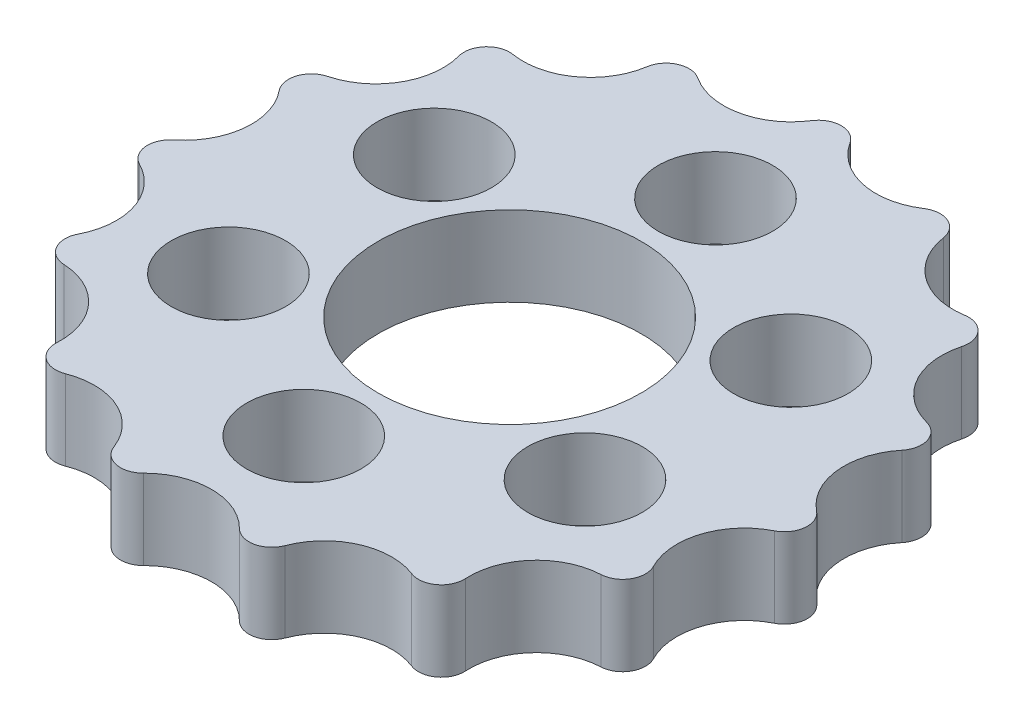
from build123d import *

# Parameters (mm, degrees)
BOSS_EXTRUDE1_DEPTH = 7
SKETCH2_R           = 5
SKETCH2_R_2         = 11.5
CUT_EXTRUDE1_DEPTH  = 42.502327226


with BuildPart() as part:
    # Sketch1 → Boss-Extrude1 (new body)
    with BuildSketch(Plane(origin=(0, 0, 0), x_dir=(1, 0, 0), z_dir=(0, 1, 0))):
        with BuildLine():
            ThreePointArc((1.682317925, 28.081575887), (0, 29), (-1.682317925, 28.081575887))
            ThreePointArc((-1.682317925, 28.081575887), (-5.420186592, 25.49997304), (-9.884932009, 26.33805644))
            ThreePointArc((-9.884932009, 26.33805644), (-11.795362649, 26.492818272), (-12.958679807, 24.969535749))
            ThreePointArc((-12.958679807, 24.969535749), (-15.323360273, 21.090796041), (-19.742987398, 20.040447761))
            ThreePointArc((-19.742987398, 20.040447761), (-21.551199939, 19.404787584), (-21.994368225, 17.540036039))
            ThreePointArc((-21.994368225, 17.540036039), (-22.576985755, 13.034828803), (-26.187300906, 10.277663603))
            ThreePointArc((-26.187300906, 10.277663603), (-27.580638973, 8.961492837), (-27.227030564, 7.077704752))
            ThreePointArc((-27.227030564, 7.077704752), (-25.926845294, 2.725021248), (-28.103592183, -1.262221962))
            ThreePointArc((-28.103592183, -1.262221962), (-28.841134966, -3.031325435), (-27.751891968, -4.608425985))
            ThreePointArc((-27.751891968, -4.608425985), (-24.793717744, -8.055967238), (-25.160517059, -12.583857883))
            ThreePointArc((-25.160517059, -12.583857883), (-25.11473671, -14.5), (-23.478199133, -15.497718004))
            ThreePointArc((-23.478199133, -15.497718004), (-19.373531152, -17.444005802), (-17.866959959, -21.729630455))
            ThreePointArc((-17.866959959, -21.729630455), (-17.045772316, -23.461492837), (-15.144912376, -23.707313787))
            ThreePointArc((-15.144912376, -23.707313787), (-10.603485021, -23.815817289), (-7.484043166, -27.118152514))
            ThreePointArc((-7.484043166, -27.118152514), (-6.029439034, -28.366280421), (-4.192932681, -27.817699643))
            ThreePointArc((-4.192932681, -27.817699643), (0, -26.069657606), (4.192932681, -27.817699643))
            ThreePointArc((4.192932681, -27.817699643), (6.029439034, -28.366280421), (7.484043166, -27.118152514))
            ThreePointArc((7.484043166, -27.118152514), (10.603485021, -23.815817289), (15.144912376, -23.707313787))
            ThreePointArc((15.144912376, -23.707313787), (17.045772316, -23.461492837), (17.866959959, -21.729630455))
            ThreePointArc((17.866959959, -21.729630455), (19.373531152, -17.444005802), (23.478199133, -15.497718004))
            ThreePointArc((23.478199133, -15.497718004), (25.11473671, -14.5), (25.160517059, -12.583857883))
            ThreePointArc((25.160517059, -12.583857883), (24.793717744, -8.055967238), (27.751891968, -4.608425985))
            ThreePointArc((27.751891968, -4.608425985), (28.841134966, -3.031325435), (28.103592183, -1.262221962))
            ThreePointArc((28.103592183, -1.262221962), (25.926845294, 2.725021248), (27.227030564, 7.077704752))
            ThreePointArc((27.227030564, 7.077704752), (27.580638973, 8.961492837), (26.187300906, 10.277663603))
            ThreePointArc((26.187300906, 10.277663603), (22.576985755, 13.034828803), (21.994368225, 17.540036039))
            ThreePointArc((21.994368225, 17.540036039), (21.551199939, 19.404787584), (19.742987398, 20.040447761))
            ThreePointArc((19.742987398, 20.040447761), (15.323360273, 21.090796041), (12.958679807, 24.969535749))
            ThreePointArc((12.958679807, 24.969535749), (11.795362649, 26.492818272), (9.884932009, 26.33805644))
            ThreePointArc((9.884932009, 26.33805644), (5.420186592, 25.49997304), (1.682317925, 28.081575887))
        make_face()
    extrude(amount=BOSS_EXTRUDE1_DEPTH)

    # Sketch2 → Cut-Extrude1 (cut, through all)
    with BuildSketch(Plane(origin=(0, 7, 0), x_dir=(1, 0, 0), z_dir=(0, 1, 0))):
        with Locations(Location((0, 18, 0), (0, 0, 270))):
            Circle(SKETCH2_R)
        with Locations(Location((0, 0, 0), (0, 0, 270))):
            Circle(SKETCH2_R_2)
        with Locations(Location((-15.588457268, -9, 0), (0, 0, 270))):
            Circle(SKETCH2_R)
        with Locations(Location((0, -18, 0), (0, 0, 270))):
            Circle(SKETCH2_R)
        with Locations(Location((15.588457268, -9, 0), (0, 0, 270))):
            Circle(SKETCH2_R)
        with Locations(Location((15.588457268, 9, 0), (0, 0, 270))):
            Circle(SKETCH2_R)
        with Locations(Location((-15.588457268, 9, 0), (0, 0, 270))):
            Circle(SKETCH2_R)
    extrude(amount=-CUT_EXTRUDE1_DEPTH, mode=Mode.SUBTRACT)


solid = part.part
